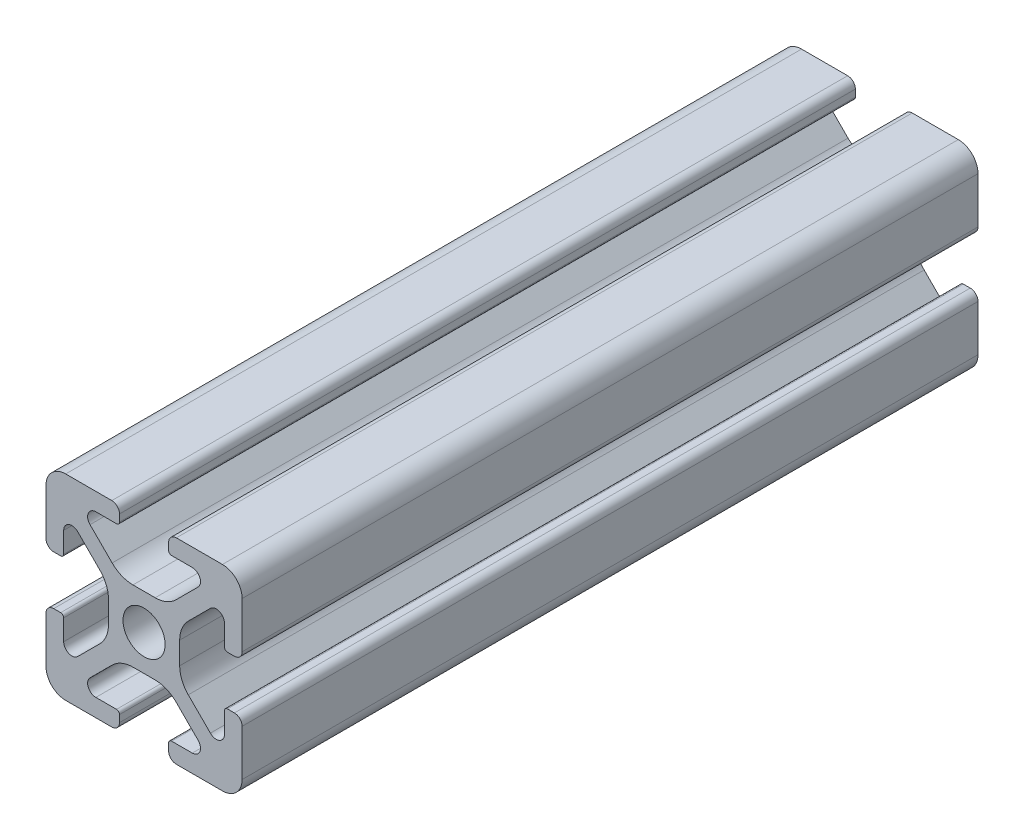
from build123d import *

# Parameters (mm, degrees)
SKETCH1_R           = 2.1463
BOSS_EXTRUDE1_DEPTH = 37.5


with BuildPart() as part:
    # Sketch1 → Boss-Extrude1 (new, symmetric)
    with BuildSketch(Plane.XY):
        with BuildLine():
            Line((-9.9949, 7.9883), (-9.9949, 3.2893))
            ThreePointArc((-9.9949, 3.2893), (-9.76427588, 2.73252412), (-9.2075, 2.5019))
            Line((-9.2075, 2.5019), (-8.4963, 2.5019))
            ThreePointArc((-8.4963, 2.5019), (-8.280773853, 2.591173853), (-8.1915, 2.8067))
            Line((-8.1915, 2.8067), (-8.1915, 4.9149))
            ThreePointArc((-8.1915, 4.9149), (-7.674065253, 5.689295824), (-6.760603096, 5.507596904))
            Line((-6.760603096, 5.507596904), (-4.505765747, 3.252759555))
            ThreePointArc((-4.505765747, 3.252759555), (-3.856054457, 2.280397894), (-3.627906192, 1.133419111))
            Line((-3.627906192, 1.133419111), (-3.627906192, -1.133419111))
            ThreePointArc((-3.627906192, -1.133419111), (-3.856054457, -2.280397894), (-4.505765747, -3.252759555))
            Line((-4.505765747, -3.252759555), (-6.760603096, -5.507596904))
            ThreePointArc((-6.760603096, -5.507596904), (-7.674065253, -5.689295824), (-8.1915, -4.9149))
            Line((-8.1915, -4.9149), (-8.1915, -2.8067))
            ThreePointArc((-8.1915, -2.8067), (-8.280773853, -2.591173853), (-8.4963, -2.5019))
            Line((-8.4963, -2.5019), (-9.2075, -2.5019))
            ThreePointArc((-9.2075, -2.5019), (-9.76427588, -2.73252412), (-9.9949, -3.2893))
            Line((-9.9949, -3.2893), (-9.9949, -7.9883))
            ThreePointArc((-9.9949, -7.9883), (-9.407180467, -9.407180467), (-7.9883, -9.9949))
            Line((-7.9883, -9.9949), (-3.2893, -9.9949))
            ThreePointArc((-3.2893, -9.9949), (-2.73252412, -9.76427588), (-2.5019, -9.2075))
            Line((-2.5019, -9.2075), (-2.5019, -8.4963))
            ThreePointArc((-2.5019, -8.4963), (-2.591173853, -8.280773853), (-2.8067, -8.1915))
            Line((-2.8067, -8.1915), (-4.9149, -8.1915))
            ThreePointArc((-4.9149, -8.1915), (-5.689295824, -7.674065253), (-5.507596904, -6.760603096))
            Line((-5.507596904, -6.760603096), (-3.252759555, -4.505765747))
            ThreePointArc((-3.252759555, -4.505765747), (-2.280397894, -3.856054457), (-1.133419111, -3.627906192))
            Line((-1.133419111, -3.627906192), (1.133419111, -3.627906192))
            ThreePointArc((1.133419111, -3.627906192), (2.280397894, -3.856054457), (3.252759555, -4.505765747))
            Line((3.252759555, -4.505765747), (5.507596904, -6.760603096))
            ThreePointArc((5.507596904, -6.760603096), (5.689295824, -7.674065253), (4.9149, -8.1915))
            Line((4.9149, -8.1915), (2.8067, -8.1915))
            ThreePointArc((2.8067, -8.1915), (2.591173853, -8.280773853), (2.5019, -8.4963))
            Line((2.5019, -8.4963), (2.5019, -9.2075))
            ThreePointArc((2.5019, -9.2075), (2.73252412, -9.76427588), (3.2893, -9.9949))
            Line((3.2893, -9.9949), (7.9883, -9.9949))
            ThreePointArc((7.9883, -9.9949), (9.407180467, -9.407180467), (9.9949, -7.9883))
            Line((9.9949, -7.9883), (9.9949, -3.2893))
            ThreePointArc((9.9949, -3.2893), (9.76427588, -2.73252412), (9.2075, -2.5019))
            Line((9.2075, -2.5019), (8.4963, -2.5019))
            ThreePointArc((8.4963, -2.5019), (8.280773853, -2.591173853), (8.1915, -2.8067))
            Line((8.1915, -2.8067), (8.1915, -4.9149))
            ThreePointArc((8.1915, -4.9149), (7.674065253, -5.689295824), (6.760603096, -5.507596904))
            Line((6.760603096, -5.507596904), (4.505765747, -3.252759555))
            ThreePointArc((4.505765747, -3.252759555), (3.856054457, -2.280397894), (3.627906192, -1.133419111))
            Line((3.627906192, -1.133419111), (3.627906192, 1.133419111))
            ThreePointArc((3.627906192, 1.133419111), (3.856054457, 2.280397894), (4.505765747, 3.252759555))
            Line((4.505765747, 3.252759555), (6.760603096, 5.507596904))
            ThreePointArc((6.760603096, 5.507596904), (7.674065253, 5.689295824), (8.1915, 4.9149))
            Line((8.1915, 4.9149), (8.1915, 2.8067))
            ThreePointArc((8.1915, 2.8067), (8.280773853, 2.591173853), (8.4963, 2.5019))
            Line((8.4963, 2.5019), (9.2075, 2.5019))
            ThreePointArc((9.2075, 2.5019), (9.76427588, 2.73252412), (9.9949, 3.2893))
            Line((9.9949, 3.2893), (9.9949, 7.9883))
            ThreePointArc((9.9949, 7.9883), (9.407180467, 9.407180467), (7.9883, 9.9949))
            Line((7.9883, 9.9949), (3.2893, 9.9949))
            ThreePointArc((3.2893, 9.9949), (2.73252412, 9.76427588), (2.5019, 9.2075))
            Line((2.5019, 9.2075), (2.5019, 8.4963))
            ThreePointArc((2.5019, 8.4963), (2.591173853, 8.280773853), (2.8067, 8.1915))
            Line((2.8067, 8.1915), (4.9149, 8.1915))
            ThreePointArc((4.9149, 8.1915), (5.689295824, 7.674065253), (5.507596904, 6.760603096))
            Line((5.507596904, 6.760603096), (3.252759555, 4.505765747))
            ThreePointArc((3.252759555, 4.505765747), (2.280397894, 3.856054457), (1.133419111, 3.627906192))
            Line((1.133419111, 3.627906192), (-1.133419111, 3.627906192))
            ThreePointArc((-1.133419111, 3.627906192), (-2.280397894, 3.856054457), (-3.252759555, 4.505765747))
            Line((-3.252759555, 4.505765747), (-5.507596904, 6.760603096))
            ThreePointArc((-5.507596904, 6.760603096), (-5.689295824, 7.674065253), (-4.9149, 8.1915))
            Line((-4.9149, 8.1915), (-2.8067, 8.1915))
            ThreePointArc((-2.8067, 8.1915), (-2.591173853, 8.280773853), (-2.5019, 8.4963))
            Line((-2.5019, 8.4963), (-2.5019, 9.2075))
            ThreePointArc((-2.5019, 9.2075), (-2.73252412, 9.76427588), (-3.2893, 9.9949))
            Line((-3.2893, 9.9949), (-7.9883, 9.9949))
            ThreePointArc((-7.9883, 9.9949), (-9.407180467, 9.407180467), (-9.9949, 7.9883))
        make_face()
        Circle(SKETCH1_R, mode=Mode.SUBTRACT)
    extrude(amount=BOSS_EXTRUDE1_DEPTH, both=True)


solid = part.part
